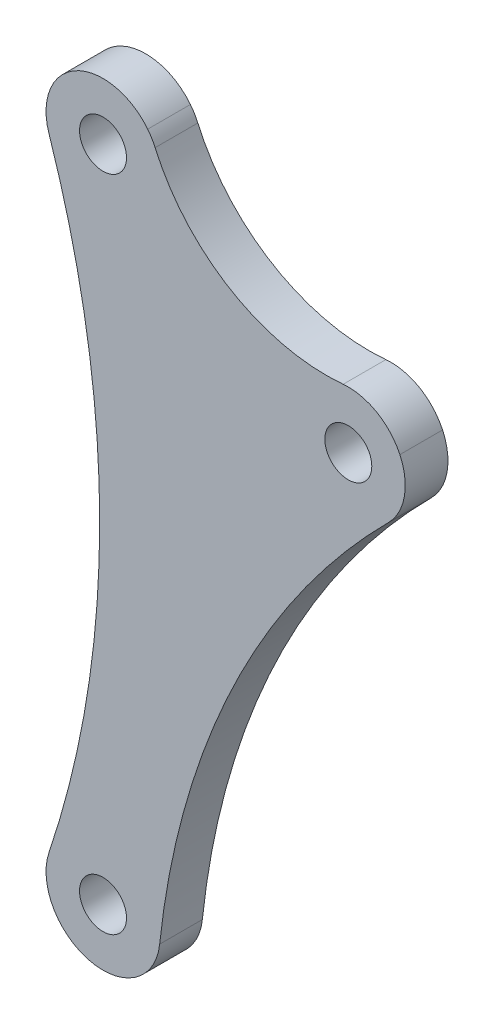
from build123d import *

# Parameters (mm, degrees)
SKETCH_1_R          = 1.35
SKETCH_1_R_2        = 1.65
SKETCH_1_R_3        = 1.3
EXTRUDE_1_DEPTH     = 3
SKETCH_2_R          = 1.65
CUT_EXTRUDE_1_DEPTH = 40.58429055
CUT_EXTRUDE_2_DEPTH = 1


with BuildPart() as part:
    # 草图1 → 凸台-拉伸1 (new body)
    with BuildSketch(Plane(origin=(0, 0, 0), x_dir=(-1, 0, 0), z_dir=(0, 0, -1))):
        with BuildLine():
            Line((3.311115848, 16.021732214), (3.313115848, 16.021732214))
            ThreePointArc((3.313115848, 16.021732214), (1.422584465, 20.809546819), (-3.619383376, 19.772320768))
            ThreePointArc((-3.619383376, 19.772320768), (-3.907451025, 19.356483629), (-4.140741668, 18.907619539))
            ThreePointArc((-4.140741668, 18.907619539), (-9.493299368, 12.888445888), (-17.351741668, 11.120619539))
            ThreePointArc((-17.351741668, 11.120619539), (-19.703460244, 10.604408599), (-21.333741668, 8.832619539))
            ThreePointArc((-21.333741668, 8.832619539), (-21.651545732, 6.446374123), (-20.542741668, 4.309619539))
            ThreePointArc((-20.542741668, 4.309619539), (-9.614805592, -11.161234041), (-4.459741668, -29.387380461))
            ThreePointArc((-4.459741668, -29.387380461), (-3.626617209, -31.434284825), (-1.833741668, -32.726380461))
            ThreePointArc((-1.833741668, -32.726380461), (0.370527809, -32.871130249), (2.315258332, -31.823380461))
            ThreePointArc((2.315258332, -31.823380461), (3.407459975, -29.901725556), (3.313258332, -27.693380461))
            ThreePointArc((3.313258332, -27.693380461), (-0.247316641, -5.861423686), (3.295002421, 15.973502613))
            Line((3.295002421, 15.973502613), (3.311115848, 16.021732214))
        make_face()
        with Locations(Location((-17.711384152, 7.136232214, 0), (0, 0, 180))):
            Circle(SKETCH_1_R, mode=Mode.SUBTRACT)
        with Locations(Location((-0.480884152, -28.962767786, 0), (0, 0, 180))):
            Circle(SKETCH_1_R_2, mode=Mode.SUBTRACT)
        with Locations(Location((-0.480884152, 17.291232214, 0), (0, 0, 180))):
            Circle(SKETCH_1_R_3, mode=Mode.SUBTRACT)
    extrude(amount=-EXTRUDE_1_DEPTH)

    # 草图2 → 切除-拉伸1 (cut, through all)
    with BuildSketch(Plane.XY.offset(3)):
        with Locations((0.480884152, 17.291232214)):
            Circle(SKETCH_2_R)
        with Locations((17.711384152, 7.136232214)):
            Circle(SKETCH_2_R)
    extrude(amount=-CUT_EXTRUDE_1_DEPTH, mode=Mode.SUBTRACT)

    # 草图3 → 切除-拉伸2 (cut)
    # profile 1 of 2: a face of its own
    with BuildSketch(Plane(origin=(0, 0, 0), x_dir=(-1, 0, 0), z_dir=(0, 0, -1))):
        Polygon((-9.088408768, 5.724720745), (-8.441273352, 5.724720745), (-8.441273352, 2.224720745), (-8.755375916, 2.224720745), (-8.755375916, 5.365746386), (-9.293837454, 5.365746386), align=None)
    # profile 2 of 2: a face of its own
    with BuildSketch(Plane(origin=(0, 0, 0), x_dir=(-1, 0, 0), z_dir=(0, 0, -1))):
        with BuildLine():
            add(Edge.make_bspline(
                [(-7.1399913, 3.973318501), (-7.139663282, 4.029415889), (-7.139026102, 4.138385873), (-7.131937681, 4.297170516), (-7.120162339, 4.446130805), (-7.104024966, 4.585273871), (-7.084386986, 4.714635635), (-7.058171499, 4.833870392), (-7.028358697, 4.943529999), (-6.993806251, 5.043972047), (-6.954818462, 5.13654975), (-6.912384201, 5.222974952), (-6.864819407, 5.303116884), (-6.814842494, 5.378254674), (-6.760430422, 5.447158369), (-6.703131632, 5.510801032), (-6.640709755, 5.567711782), (-6.575286747, 5.619558085), (-6.506270283, 5.665007556), (-6.435627617, 5.705040295), (-6.362872511, 5.739240162), (-6.287806328, 5.766130598), (-6.21110377, 5.788341445), (-6.132496703, 5.803530392), (-6.051855339, 5.813087301), (-5.997423905, 5.814000969), (-5.969819025, 5.814464335)],
                knots=[0, 0, 0, 0, 1.646270934, 3.197905019, 4.663502075, 6.030701355, 7.308322542, 8.50163776, 9.611534131, 10.641858119, 11.616356847, 12.558055219, 13.465016945, 14.349605745, 15.204443733, 16.039544428, 16.859896111, 17.680448484, 18.487036065, 19.28249412, 20.06191084, 20.843045899, 21.620316918, 22.403196591, 23.190181807, 24, 24, 24, 24], degree=3))
            add(Edge.make_bspline(
                [(-5.969819025, 5.814464335), (-5.941983546, 5.81397652), (-5.886627537, 5.813006409), (-5.804787162, 5.803682466), (-5.72483748, 5.788211343), (-5.647119342, 5.766290368), (-5.570994355, 5.739094692), (-5.497057948, 5.705007575), (-5.424850866, 5.665328707), (-5.355520578, 5.61870483), (-5.288305963, 5.566722554), (-5.224858, 5.507959885), (-5.165170914, 5.443010166), (-5.108495609, 5.372568302), (-5.056440012, 5.295283217), (-5.006866579, 5.212499107), (-4.962494544, 5.122768242), (-4.919759868, 5.027587775), (-4.882872882, 4.924324116), (-4.849606636, 4.813559355), (-4.822727668, 4.693985168), (-4.800338395, 4.566228923), (-4.782993499, 4.42982144), (-4.770360857, 4.285055124), (-4.763687772, 4.131834734), (-4.762431071, 4.027076885), (-4.761786172, 3.973318501)],
                knots=[0, 0, 0, 0, 0.810914788, 1.612654377, 2.396697861, 3.181598691, 3.963628158, 4.749916497, 5.551656086, 6.361998678, 7.18212741, 8.025565596, 8.878627764, 9.750805457, 10.657531673, 11.591944965, 12.560506719, 13.57287815, 14.630710178, 15.753379473, 16.941251878, 18.199788006, 19.531962791, 20.947069417, 22.433333509, 24, 24, 24, 24], degree=3))
            add(Edge.make_bspline(
                [(-4.761786172, 3.973318501), (-4.762437757, 3.919794594), (-4.763707343, 3.815505442), (-4.770286049, 3.662974466), (-4.783244681, 3.518976423), (-4.799454669, 3.383165961), (-4.821905632, 3.256108342), (-4.849510798, 3.137363893), (-4.880161121, 3.026419822), (-4.917995915, 2.92418501), (-4.959406625, 2.829233287), (-5.004461822, 2.740566139), (-5.052731648, 2.657399846), (-5.105320393, 2.580400099), (-5.161373806, 2.509021442), (-5.222091595, 2.444523819), (-5.28576218, 2.385353148), (-5.353174596, 2.33270152), (-5.423586147, 2.286616715), (-5.495545224, 2.245402865), (-5.570328607, 2.21217017), (-5.64624156, 2.183635129), (-5.724369926, 2.161834677), (-5.804616317, 2.146760822), (-5.886572553, 2.136188973), (-5.941974118, 2.135382493), (-5.969819025, 2.134977155)],
                knots=[0, 0, 0, 0, 1.561518951, 3.042555995, 4.452378317, 5.7783523, 7.031515105, 8.214008947, 9.334062868, 10.386615937, 11.391082383, 12.354592575, 13.286541444, 14.194233754, 15.072674879, 15.931287219, 16.775624067, 17.606195743, 18.42308326, 19.229000347, 20.022332153, 20.807536673, 21.593273796, 22.3848459, 23.188221202, 24, 24, 24, 24], degree=3))
            add(Edge.make_bspline(
                [(-5.969819025, 2.134977155), (-5.997423139, 2.135443511), (-6.051853064, 2.136363073), (-6.132505489, 2.145876804), (-6.210787932, 2.161172307), (-6.287086686, 2.182588911), (-6.361793202, 2.208803748), (-6.433889488, 2.242957431), (-6.504177172, 2.2822915), (-6.572468728, 2.327086922), (-6.637480889, 2.378408605), (-6.699579494, 2.435172894), (-6.757204513, 2.498796305), (-6.810838609, 2.568274228), (-6.861812697, 2.64296747), (-6.90870207, 2.723895843), (-6.952072925, 2.810738454), (-6.991716415, 2.904056365), (-7.026865079, 3.005211292), (-7.057912787, 3.115360471), (-7.082426944, 3.235476107), (-7.1034099, 3.364593474), (-7.120334283, 3.503267405), (-7.131888608, 3.651573183), (-7.139029923, 3.809418392), (-7.139664993, 3.917688166), (-7.1399913, 3.973318501)],
                knots=[0, 0, 0, 0, 0.810891512, 1.598919785, 2.382837074, 3.152667961, 3.926044502, 4.706494248, 5.493654104, 6.291793342, 7.103789334, 7.925228297, 8.761435821, 9.622817696, 10.50288917, 11.416980706, 12.369136599, 13.353924996, 14.394355917, 15.514179734, 16.714354668, 17.994756427, 19.357759367, 20.818452758, 22.365282078, 24, 24, 24, 24], degree=3))
        make_face()
        with BuildLine():
            add(Edge.make_bspline(
                [(-6.825888736, 3.974720745), (-6.825769289, 3.927972046), (-6.825537466, 3.837242001), (-6.819481265, 3.70539874), (-6.811231033, 3.582428412), (-6.800589736, 3.468174875), (-6.784786788, 3.363024863), (-6.76708, 3.26625518), (-6.74553191, 3.178377942), (-6.720036892, 3.098790132), (-6.690997795, 3.026141063), (-6.659291932, 2.958539848), (-6.625231209, 2.895187912), (-6.587112058, 2.836654303), (-6.545596995, 2.782748139), (-6.501623736, 2.732515307), (-6.453551152, 2.687718326), (-6.387047409, 2.633991471), (-6.299250935, 2.578472337), (-6.18863048, 2.530126247), (-6.074962029, 2.499743791), (-5.997810778, 2.495880035), (-5.959302198, 2.493951514)],
                knots=[0, 0, 0, 0, 1.459021318, 2.831673884, 4.118529203, 5.306027144, 6.411944654, 7.436330062, 8.375795394, 9.233974572, 10.042671642, 10.816086306, 11.563610507, 12.285937304, 12.993564865, 13.685989202, 14.367179055, 15.041617293, 16.353048772, 17.594441528, 18.799311195, 20, 20, 20, 20], degree=3))
            add(Edge.make_bspline(
                [(-5.959302198, 2.493951514), (-5.920544526, 2.495549295), (-5.843109203, 2.498741558), (-5.729975408, 2.529540295), (-5.620145138, 2.576009835), (-5.534073197, 2.63095734), (-5.468590654, 2.68328567), (-5.421673664, 2.727900318), (-5.378611615, 2.777856185), (-5.337769541, 2.831755481), (-5.300310465, 2.890627965), (-5.266247327, 2.954190541), (-5.23516398, 3.022619718), (-5.217454934, 3.070389458), (-5.208400756, 3.094812892)],
                knots=[0, 0, 0, 0, 1.353760809, 2.704726607, 4.075137775, 5.516104923, 6.260822281, 7.007110065, 7.778089737, 8.566572457, 9.372053459, 10.217411131, 11.088608312, 12, 12, 12, 12], degree=3))
            add(Edge.make_bspline(
                [(-5.208400756, 3.094812892), (-5.197848988, 3.126042632), (-5.176424374, 3.189452396), (-5.1488126, 3.287816048), (-5.1270672, 3.391018812), (-5.107503835, 3.498443929), (-5.094150779, 3.61088363), (-5.083402966, 3.727990014), (-5.077072279, 3.849851376), (-5.076287527, 3.932646367), (-5.075888736, 3.974720745)],
                knots=[0, 0, 0, 0, 0.884706709, 1.796334032, 2.740027952, 3.714592787, 4.726048262, 5.777819803, 6.87074269, 8, 8, 8, 8], degree=3))
            add(Edge.make_bspline(
                [(-5.075888736, 3.974720745), (-5.076438926, 4.016788318), (-5.077515213, 4.099081482), (-5.081629201, 4.219599663), (-5.092252775, 4.334067424), (-5.104051894, 4.442977897), (-5.121449115, 4.545728199), (-5.140206922, 4.643178505), (-5.165408135, 4.734121529), (-5.19232791, 4.819981111), (-5.223138305, 4.899781766), (-5.257054039, 4.973895552), (-5.293275798, 5.042680277), (-5.332618039, 5.105947218), (-5.374613722, 5.163979761), (-5.420371271, 5.215614356), (-5.468075644, 5.262451324), (-5.53489283, 5.315913893), (-5.622367119, 5.370425588), (-5.731212767, 5.420591348), (-5.844483411, 5.449399641), (-5.921056865, 5.453461328), (-5.959302198, 5.455489976)],
                knots=[0, 0, 0, 0, 1.31362396, 2.569729283, 3.763502607, 4.902122613, 5.988968491, 7.01645872, 7.998833611, 8.933434873, 9.825090667, 10.667526885, 11.477055099, 12.250526234, 12.991942729, 13.710640831, 14.402115721, 15.076753259, 16.378508321, 17.609869233, 18.806226677, 20, 20, 20, 20], degree=3))
            add(Edge.make_bspline(
                [(-5.959302198, 5.455489976), (-5.99801279, 5.453458529), (-6.075504496, 5.449391935), (-6.18995245, 5.420698681), (-6.299656802, 5.370685716), (-6.386899777, 5.315733343), (-6.453763563, 5.263395032), (-6.500846256, 5.218008578), (-6.544992429, 5.168362323), (-6.585660129, 5.113960408), (-6.623749412, 5.055495041), (-6.658730425, 4.992506276), (-6.690247754, 4.924674912), (-6.71933229, 4.852058477), (-6.744905078, 4.772477532), (-6.765999042, 4.684708539), (-6.785486095, 4.588246647), (-6.799281364, 4.482527139), (-6.811545119, 4.368244986), (-6.819426467, 4.244967667), (-6.825557725, 4.112903287), (-6.825776189, 4.021704128), (-6.825888736, 3.974720745)],
                knots=[0, 0, 0, 0, 1.207732386, 2.417664972, 3.655092373, 4.956220595, 5.625982001, 6.301752483, 6.994047911, 7.697131622, 8.419323945, 9.170223765, 9.943494443, 10.752040957, 11.610060368, 12.549350801, 13.567764191, 14.679664412, 15.874934091, 17.154273443, 18.533957287, 20, 20, 20, 20], degree=3))
        make_face(mode=Mode.SUBTRACT)
    extrude(amount=-CUT_EXTRUDE_2_DEPTH, mode=Mode.SUBTRACT)


solid = part.part
